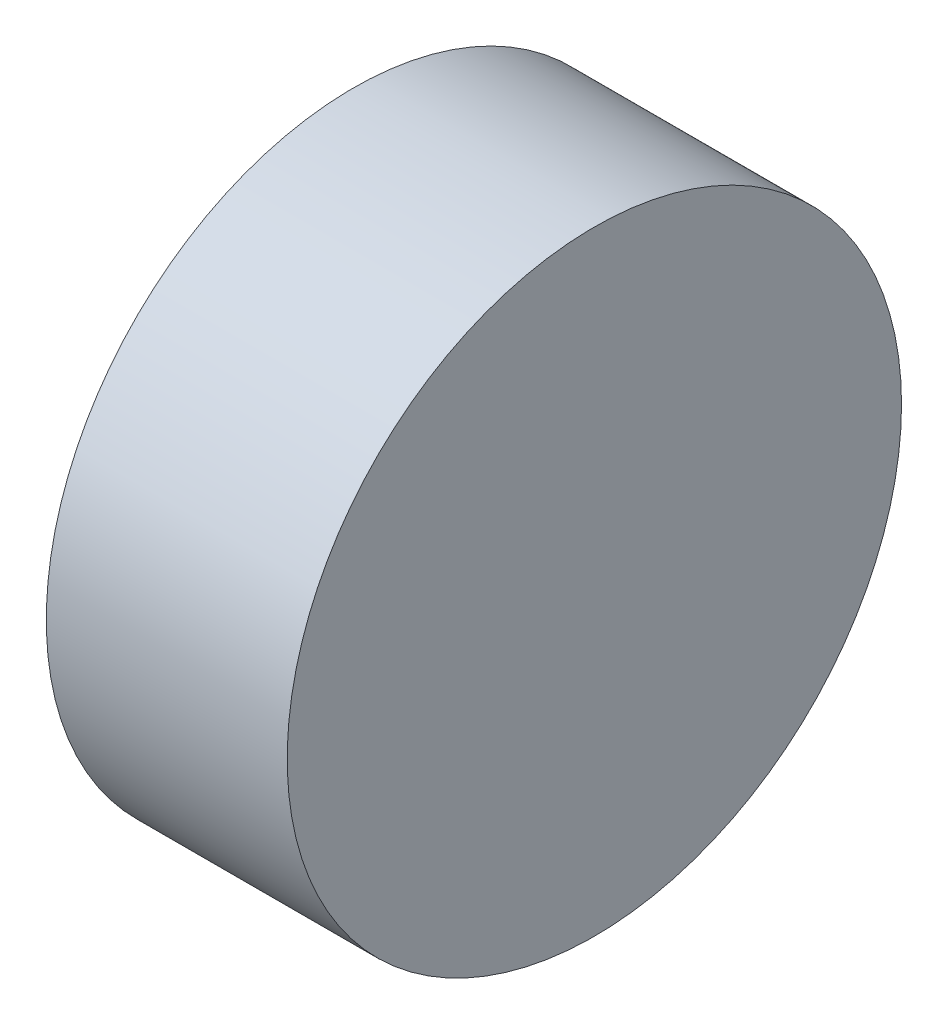
from build123d import *

# Parameters (mm, degrees)
SKETCH_1_R      = 51
EXTRUDE_1_DEPTH = 40
SKETCH_2_R      = 23
EXTRUDE_2_DEPTH = 10


with BuildPart() as part:
    # 草图1 → 凸台-拉伸1 (new body)
    with BuildSketch(Plane(origin=(0, 0, 0), x_dir=(0, 0, -1), z_dir=(1, 0, 0))):
        Circle(SKETCH_1_R)
    extrude(amount=EXTRUDE_1_DEPTH)

    # 草图2 → 凸台-拉伸2 (add)
    with BuildSketch(Plane.ZY):
        Circle(SKETCH_2_R)
    extrude(amount=EXTRUDE_2_DEPTH)


solid = part.part
